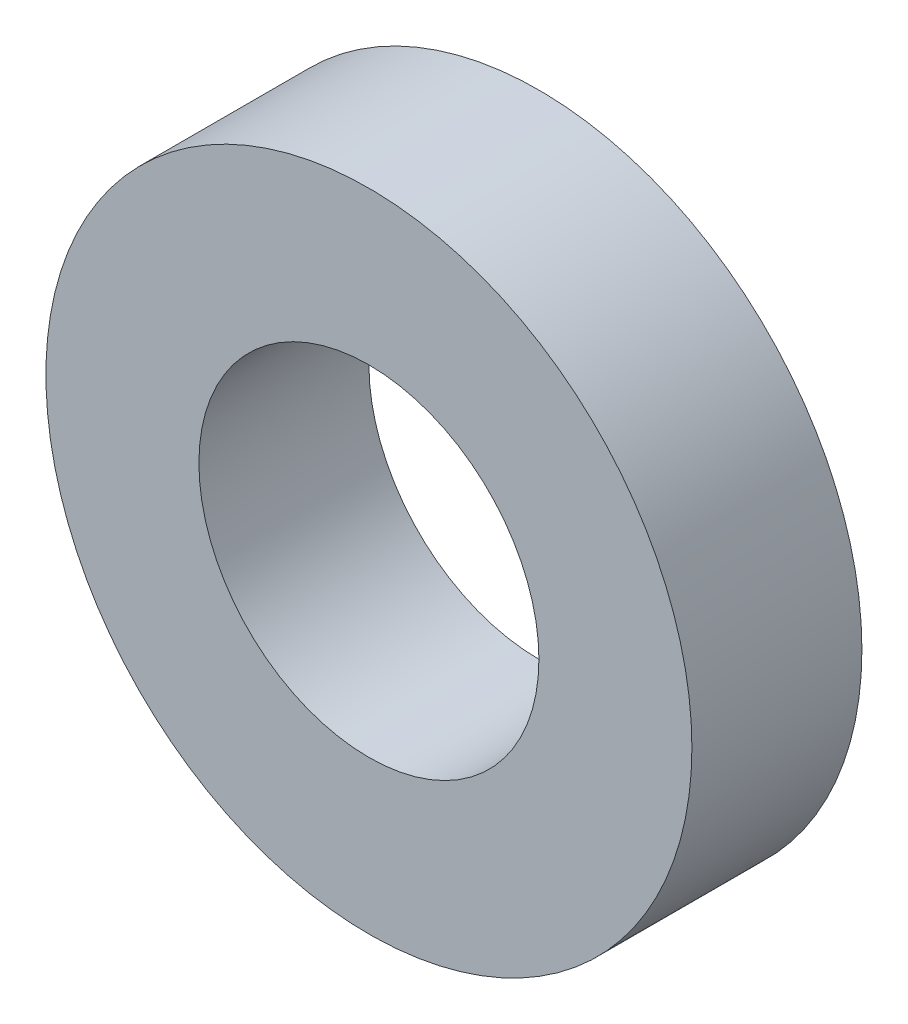
from build123d import *

# Parameters (mm, degrees)
SKETCH1_R           = 9.5
BOSS_EXTRUDE1_DEPTH = 5
SKETCH2_R           = 5
CUT_EXTRUDE1_DEPTH  = 5


with BuildPart() as part:
    # Sketch1 → Boss-Extrude1 (new body)
    with BuildSketch(Plane.XY):
        Circle(SKETCH1_R)
    extrude(amount=BOSS_EXTRUDE1_DEPTH)

    # Sketch2 → Cut-Extrude1 (cut)
    with BuildSketch(Plane.XY.offset(5)):
        Circle(SKETCH2_R)
    extrude(amount=-CUT_EXTRUDE1_DEPTH, mode=Mode.SUBTRACT)


solid = part.part
